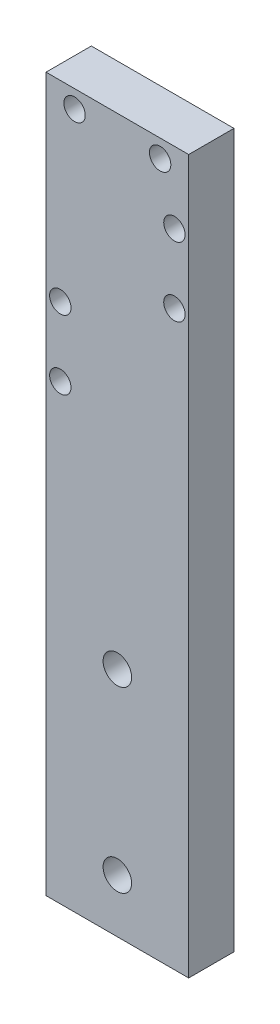
from build123d import *

# Parameters (mm, degrees)
SKETCH1_W           = 20
SKETCH1_H           = 40
SKETCH1_R           = 2
BOSS_EXTRUDE1_DEPTH = 6.35
SKETCH3_W           = 20
SKETCH3_H           = 6.35
BOSS_EXTRUDE3_DEPTH = 60
SKETCH6_R           = 1.5
CUT_EXTRUDE1_DEPTH  = 23.2


with BuildPart() as part:
    # Sketch1 → Boss-Extrude1 (new body)
    with BuildSketch(Plane.XY):
        with Locations((10, 20)):
            Rectangle(SKETCH1_W, SKETCH1_H)
        with Locations((10, 32.5)):
            Circle(SKETCH1_R, mode=Mode.SUBTRACT)
        with Locations((10, 7.5)):
            Circle(SKETCH1_R, mode=Mode.SUBTRACT)
    extrude(amount=BOSS_EXTRUDE1_DEPTH)

    # Sketch3 → Boss-Extrude3 (add)
    with BuildSketch(Plane(origin=(0, 40, 0), x_dir=(1, 0, 0), z_dir=(0, 1, 0))):
        with Locations((10, -3.175)):
            Rectangle(SKETCH3_W, SKETCH3_H)
    extrude(amount=BOSS_EXTRUDE3_DEPTH)

    # Sketch6 → Cut-Extrude1 (cut)
    with BuildSketch(Plane(origin=(0, 0, 0), x_dir=(-1, 0, 0), z_dir=(0, 0, -1))):
        with Locations((-16, 97.5)):
            Circle(SKETCH6_R)
        with Locations((-4, 97.5)):
            Circle(SKETCH6_R)
        with Locations((-18, 90)):
            Circle(SKETCH6_R)
        with Locations((-2, 63.448163905)):
            Circle(SKETCH6_R)
        with Locations((-2, 73.131019592)):
            Circle(SKETCH6_R)
        with Locations((-18, 80.317144313)):
            Circle(SKETCH6_R)
    extrude(amount=-CUT_EXTRUDE1_DEPTH, mode=Mode.SUBTRACT)


solid = part.part
